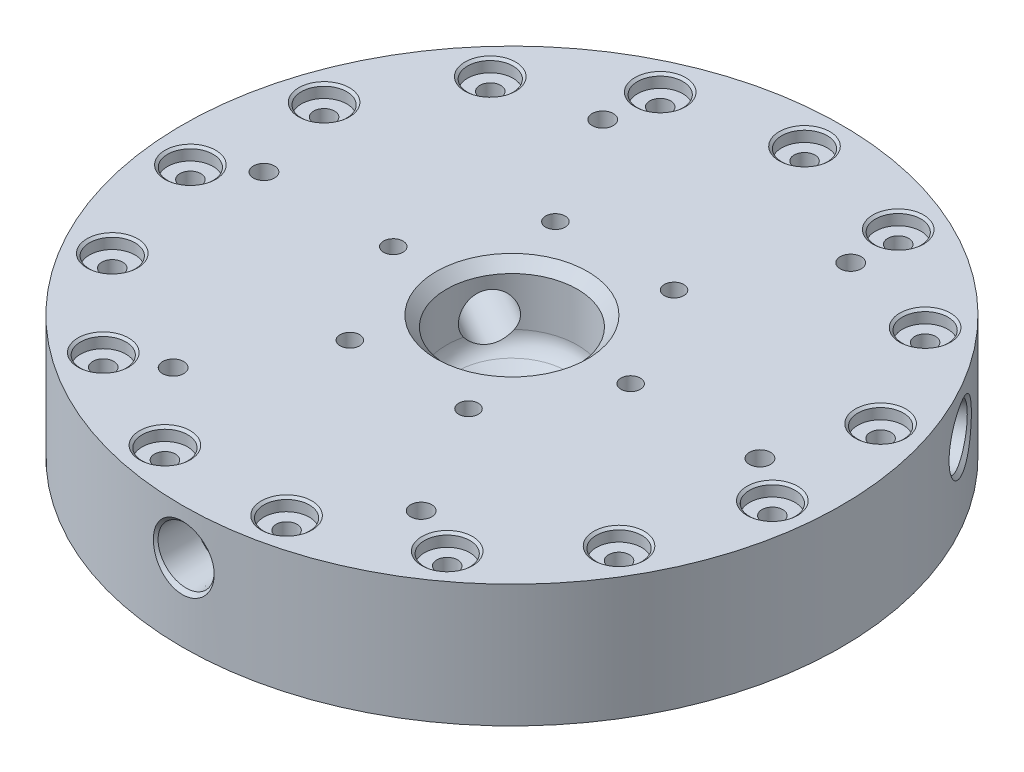
from build123d import *

# Parameters (mm, degrees)
SKETCH1_R           = 80.54
BOSS_EXTRUDE1_DEPTH = 30
CIRPATTERN1_COUNT   = 3
CIRPATTERN2_COUNT   = 15
CIRPATTERN3_COUNT   = 6
SKETCH21_W          = 5
SKETCH21_H          = 3
CHAMFER1_SIZE       = 2.5
CIRPATTERN4_COUNT   = 6


with BuildPart() as part:
    # Sketch1 → Boss-Extrude1 (new body)
    with BuildSketch(Plane(origin=(0, 0, 0), x_dir=(1, 0, 0), z_dir=(0, 1, 0))):
        with Locations(Location((0, 0, 0), (0, 0, 270))):
            Circle(SKETCH1_R)
    extrude(amount=BOSS_EXTRUDE1_DEPTH)

    # Sketch2 → Cut-Revolve1 (revolve, cut)
    with BuildSketch(Plane.XY):
        with BuildLine():
            Line((-5.953252, 0), (-5.953252, 4.113248654))
            ThreePointArc((-5.953252, 4.113248654), (-6.623124981, 6.613248654), (-8.453252, 8.443375673))
            Line((-8.453252, 8.443375673), (-13.5, 11.357116989))
            ThreePointArc((-13.5, 11.357116989), (-15.330127019, 13.187244008), (-16, 15.687244008))
            Line((-16, 15.687244008), (-16, 30))
            Line((-16, 30), (0, 30))
            Line((0, 30), (0, 0))
            Line((0, 0), (-5.953252, 0))
        make_face()
    revolve(axis=Axis((0, 30, 0), (0, -1, 0)), mode=Mode.SUBTRACT)

    # Sketch5 → 1/4 NPT Tapped Hole1 (revolve, cut)
    with BuildSketch(Plane(origin=(0, 18.904757199, 80.54), x_dir=(0, -1, 0), z_dir=(1, 0, 0))):
        Polygon((0, 0), (0, 83.882347279), (5.5626, 80.54), (5.5626, 10.02), (6.58554395, 10.02), (6.8579873, 0.9207627), (7.77875, 0), align=None)
    f_1_4_npt_tapped_hole1 = revolve(axis=Axis((0, 18.904757199, 86.89), (0, 0, -1)), mode=Mode.SUBTRACT)

    # CirPattern1: 1/4 NPT Tapped Hole1 ×3 about axis
    cirpattern1_axis = Axis((0, 0, 0), (0, 1, 0))
    for i in range(1, CIRPATTERN1_COUNT):
        add(f_1_4_npt_tapped_hole1.rotate(cirpattern1_axis, i * 360 / CIRPATTERN1_COUNT), mode=Mode.SUBTRACT)

    # Sketch7 → CBORE for #10 Binding Head Machine Screw1 (revolve, cut)
    with BuildSketch(Plane(origin=(0, 30, -71.5), x_dir=(0, 0, 1), z_dir=(1, 0, 0))):
        Polygon((0, 0), (0, 30), (2.5527, 30), (2.5527, 3.1242), (5.55625, 3.1242), (5.55625, 0.532828266), (6.19125, 0), align=None)
    cbore_for_10_binding_head_machine_screw = revolve(axis=Axis((0, 36.35, -71.5), (0, -1, 0)), mode=Mode.SUBTRACT)

    # CirPattern2: CBORE for #10 Binding Head Machine Screw1 ×15 about axis
    cirpattern2_axis = Axis((0, 0, 0), (0, 1, 0))
    for i in range(1, CIRPATTERN2_COUNT):
        add(cbore_for_10_binding_head_machine_screw.rotate(cirpattern2_axis, i * 360 / CIRPATTERN2_COUNT), mode=Mode.SUBTRACT)

    # Sketch19 → 13/64 (0.20313) Diameter Hole3 (revolve, cut)
    with BuildSketch(Plane(origin=(30.305, 30, -52.489799723), x_dir=(0, 0, 1), z_dir=(1, 0, 0))):
        Polygon((0, 0), (0, 14.250070783), (2.579751, 12.7), (2.579751, 0), align=None)
    f_13_64_0_20313_diameter_hole3 = revolve(axis=Axis((30.305, 36.35, -52.489799723), (0, -1, 0)), mode=Mode.SUBTRACT)

    # CirPattern3: 13/64 (0.20313) Diameter Hole3 ×6 about axis
    cirpattern3_axis = Axis((0, 0, 0), (0, 1, 0))
    for i in range(1, CIRPATTERN3_COUNT):
        add(f_13_64_0_20313_diameter_hole3.rotate(cirpattern3_axis, i * 360 / CIRPATTERN3_COUNT), mode=Mode.SUBTRACT)

    # Sketch21 → Cut-Revolve2 (revolve, cut)
    with BuildSketch(Plane.XY, mode=Mode.PRIVATE) as cut_revolve2_sk:
        with Locations((62.5, 1.5)):
            Rectangle(SKETCH21_W, SKETCH21_H)
    revolve(cut_revolve2_sk.sketch.rotate(Axis((0, 0, 0), (0, -1, 0)), 90), axis=Axis((0, 0, 0), (0, -1, 0)), mode=Mode.SUBTRACT)

    # Chamfer1
    chamfer1_edges = [part.edges().sort_by_distance(p)[0] for p in [
        (16, 30, 0),
    ]]
    chamfer(chamfer1_edges, length=CHAMFER1_SIZE)

    # Sketch28 → 3/16 (0.1875) Diameter Hole1 (revolve, cut)
    with BuildSketch(Plane(origin=(29, 30, 0), x_dir=(0, 0, 1), z_dir=(1, 0, 0))):
        Polygon((0, 0), (0, 13.430799349), (2.38125, 12), (2.38125, 0), align=None)
    f_3_16_0_1875_diameter_hole1 = revolve(axis=Axis((29, 36.35, 0), (0, -1, 0)), mode=Mode.SUBTRACT)

    # CirPattern4: 3/16 (0.1875) Diameter Hole1 ×6 about axis
    cirpattern4_axis = Axis((0, 0, 0), (0, 1, 0))
    for i in range(1, CIRPATTERN4_COUNT):
        add(f_3_16_0_1875_diameter_hole1.rotate(cirpattern4_axis, i * 360 / CIRPATTERN4_COUNT), mode=Mode.SUBTRACT)


solid = part.part
